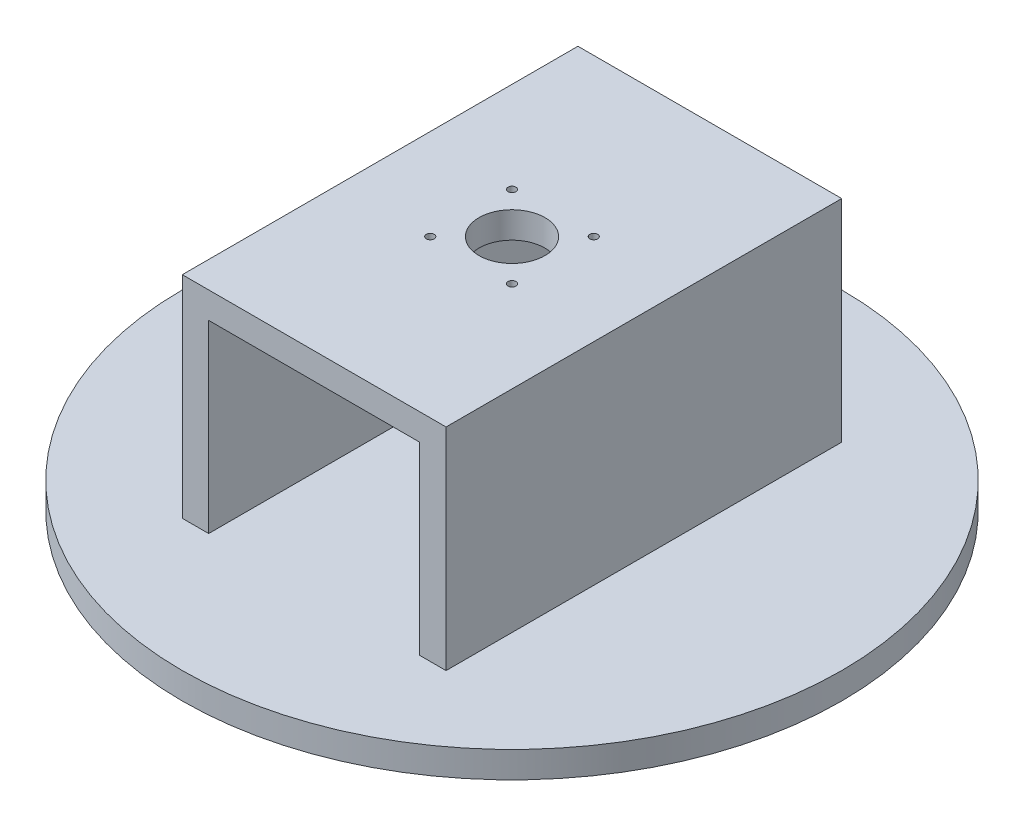
from build123d import *

# Parameters (mm, degrees)
SKETCH1_R           = 125
BOSS_EXTRUDE1_DEPTH = 10
SKETCH2_W           = 10
SKETCH2_H           = 150
BOSS_EXTRUDE2_DEPTH = 70
SKETCH3_W           = 100
SKETCH3_H           = 150
BOSS_EXTRUDE3_DEPTH = 10
SKETCH4_R           = 1.5
SKETCH4_R_2         = 12.5
CUT_EXTRUDE1_DEPTH  = 10


with BuildPart() as part:
    # Sketch1 → Boss-Extrude1 (new body)
    with BuildSketch(Plane(origin=(0, 0, 0), x_dir=(1, 0, 0), z_dir=(0, 1, 0))):
        with Locations(Location((0, 0, 0), (0, 0, 270))):
            Circle(SKETCH1_R)
    extrude(amount=BOSS_EXTRUDE1_DEPTH)

    # Sketch2 → Boss-Extrude2 (add)
    with BuildSketch(Plane(origin=(0, 10, 0), x_dir=(1, 0, 0), z_dir=(0, 1, 0))):
        with Locations((-45, 0)):
            Rectangle(SKETCH2_W, SKETCH2_H)
        with Locations((45, 0)):
            Rectangle(SKETCH2_W, SKETCH2_H)
    extrude(amount=BOSS_EXTRUDE2_DEPTH)

    # Sketch3 → Boss-Extrude3 (add)
    with BuildSketch(Plane(origin=(0, 80, 0), x_dir=(1, 0, 0), z_dir=(0, 1, 0))):
        Rectangle(SKETCH3_W, SKETCH3_H)
    extrude(amount=BOSS_EXTRUDE3_DEPTH)

    # Sketch4 → Cut-Extrude1 (cut)
    with BuildSketch(Plane(origin=(0, 90, 0), x_dir=(1, 0, 0), z_dir=(0, 1, 0))):
        with Locations(Location((-15.5, 15.5, 0), (0, 0, 270))):
            Circle(SKETCH4_R)
        with Locations(Location((15.5, 15.5, 0), (0, 0, 270))):
            Circle(SKETCH4_R)
        with Locations(Location((-15.5, -15.5, 0), (0, 0, 270))):
            Circle(SKETCH4_R)
        with Locations(Location((15.5, -15.5, 0), (0, 0, 270))):
            Circle(SKETCH4_R)
        with Locations(Location((0, 0, 0), (0, 0, 270))):
            Circle(SKETCH4_R_2)
    extrude(amount=-CUT_EXTRUDE1_DEPTH, mode=Mode.SUBTRACT)


solid = part.part
